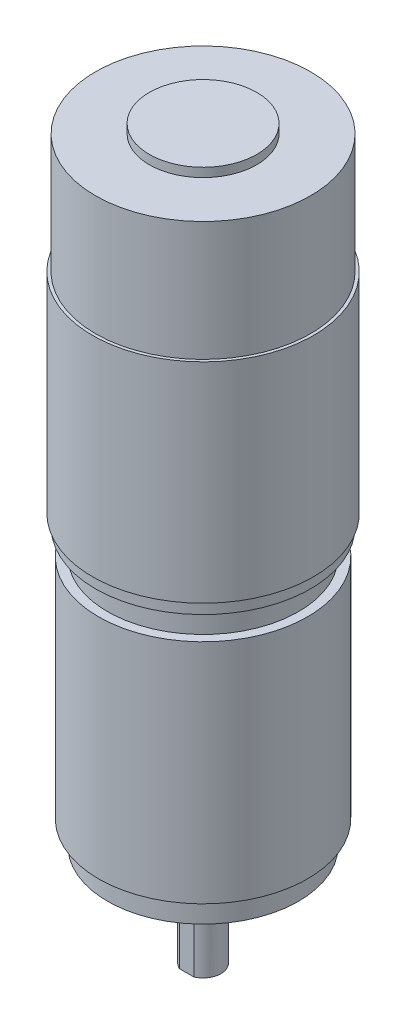
from build123d import *

# Parameters (mm, degrees)
SKETCH_4_OUTSIDE_W   = 65.512
SKETCH_4_OUTSIDE_H   = 65.512
SKETCH_4_OUTSIDE_W_2 = 6
SKETCH_4_OUTSIDE_H_2 = 5.5
CUT_EXTRUDE_2_DEPTH  = 12
SKETCH_5_R           = 1.5
CUT_EXTRUDE_3_DEPTH  = 5


with BuildPart() as part:
    # Эскиз1 → Повернуть1 (revolve)
    with BuildSketch(Plane.XY, mode=Mode.PRIVATE) as revolve_1_sk:
        Polygon((0, 0), (-9, 0), (-9, -1.5), (-18, -1.5), (-18, -21.5), (-18.5, -21.5), (-18.5, -56.5), (-18, -56.5), (-18, -58.5), (-16, -58.5), (-16, -62.8), (-17.5, -62.8), (-17.5, -100.8), (-16, -100.8), (-16, -104.8), (-10, -104.8), (-10, -106.8), (-3, -106.8), (-3, -121.8), (0, -121.8), align=None)
    revolve(revolve_1_sk.sketch.rotate(Axis((0, -180.909291234, 0), (0, 1, 0)), 270), axis=Axis((0, -180.909291234, 0), (0, 1, 0)))

    # Эскиз4 outside → Вырез-Вытянуть2 (cut)
    with BuildSketch(Plane.XZ.offset(121.8)):
        Rectangle(SKETCH_4_OUTSIDE_W, SKETCH_4_OUTSIDE_H)
        Rectangle(SKETCH_4_OUTSIDE_W_2, SKETCH_4_OUTSIDE_H_2, mode=Mode.SUBTRACT)
    extrude(amount=-CUT_EXTRUDE_2_DEPTH, mode=Mode.SUBTRACT)

    # Эскиз5 → Вырез-Вытянуть3 (cut)
    with BuildSketch(Plane.XZ.offset(104.8)):
        with Locations(Location((-9, 9, 0), (0, 0, 270))):
            Circle(SKETCH_5_R)
        with Locations(Location((9, 9, 0), (0, 0, 270))):
            Circle(SKETCH_5_R)
        with Locations(Location((9, -9, 0), (0, 0, 270))):
            Circle(SKETCH_5_R)
        with Locations(Location((-9, -9, 0), (0, 0, 270))):
            Circle(SKETCH_5_R)
    extrude(amount=-CUT_EXTRUDE_3_DEPTH, mode=Mode.SUBTRACT)


solid = part.part
